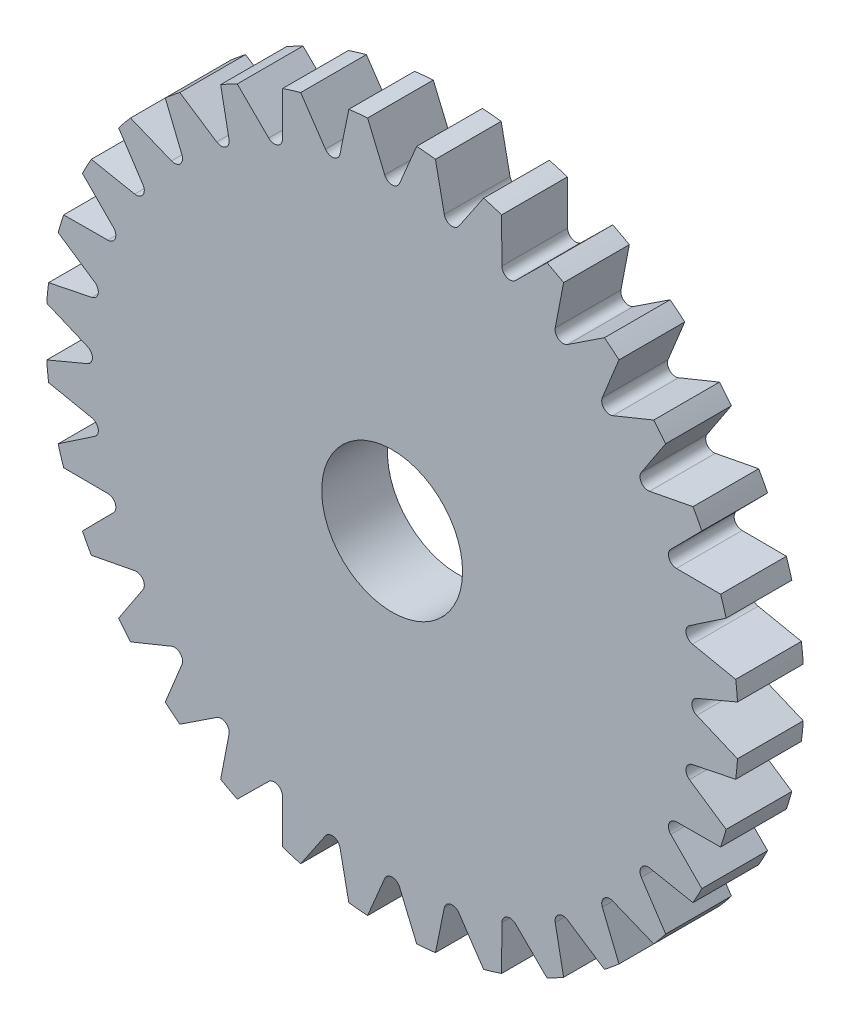
from build123d import *

# Parameters (mm, degrees)
SKETCH1_R           = 16.860601328
SKETCH1_R_2         = 3.429
BOSS_EXTRUDE1_DEPTH = 1.6002
CUT_EXTRUDE1_DEPTH  = 3.2004


with BuildPart() as part:
    # Sketch1 → Boss-Extrude1 (new, symmetric)
    with BuildSketch(Plane.XY):
        Circle(SKETCH1_R)
        Circle(SKETCH1_R_2, mode=Mode.SUBTRACT)
    extrude(amount=BOSS_EXTRUDE1_DEPTH, both=True)

    # Sketch2 → Cut-Extrude1 (cut)
    with BuildSketch(Plane.XY.offset(1.6002)):
        with BuildLine():
            Line((-1.195753421, 16.818146476), (-0.361266579, 14.83454632))
            ThreePointArc((-0.361266579, 14.83454632), (0, 14.594594775), (0.361266579, 14.83454632))
            Line((0.361266579, 14.83454632), (1.195753421, 16.818146476))
            ThreePointArc((1.195753421, 16.818146476), (0, 16.860601328), (-1.195753421, 16.818146476))
        make_face()
        with BuildLine():
            Line((4.453834966, 16.261710587), (3.248401362, 14.479025059))
            ThreePointArc((3.248401362, 14.479025059), (2.847264194, 14.314163729), (2.539751475, 14.619984285))
            Line((2.539751475, 14.619984285), (2.108280258, 16.728270427))
            ThreePointArc((2.108280258, 16.728270427), (3.289340142, 16.536629601), (4.453834966, 16.261710587))
        make_face()
        with BuildLine():
            Line((7.540758131, 15.080346281), (6.010701902, 13.567082984))
            ThreePointArc((6.010701902, 13.567082984), (5.585109623, 13.483647398), (5.343168305, 13.843584454))
            Line((5.343168305, 13.843584454), (5.331293908, 15.995536327))
            ThreePointArc((5.331293908, 15.995536327), (6.452272788, 15.577164472), (7.540758131, 15.080346281))
        make_face()
        with BuildLine():
            Line((10.33789419, 13.319452723), (8.542014538, 12.133765519))
            ThreePointArc((8.542014538, 12.133765519), (8.10832242, 12.134962059), (7.941250173, 12.535183435))
            Line((7.941250173, 12.535183435), (8.349428924, 14.648102736))
            ThreePointArc((8.349428924, 14.648102736), (9.367248208, 14.019077649), (10.33789419, 13.319452723))
        make_face()
        with BuildLine():
            Line((12.737750772, 11.046700068), (10.745062347, 10.23415425))
            ThreePointArc((10.745062347, 10.23415425), (10.319936934, 10.319936934), (10.23415425, 10.745062347))
            Line((10.23415425, 10.745062347), (11.046700068, 12.737750772))
            ThreePointArc((11.046700068, 12.737750772), (11.922245534, 11.922245534), (12.737750772, 11.046700068))
        make_face()
        with BuildLine():
            Line((14.648102736, 8.349428924), (12.535183435, 7.941250173))
            ThreePointArc((12.535183435, 7.941250173), (12.134962059, 8.10832242), (12.133765519, 8.542014538))
            Line((12.133765519, 8.542014538), (13.319452723, 10.33789419))
            ThreePointArc((13.319452723, 10.33789419), (14.019077649, 9.367248208), (14.648102736, 8.349428924))
        make_face()
        with BuildLine():
            Line((15.995536327, 5.331293908), (13.843584454, 5.343168305))
            ThreePointArc((13.843584454, 5.343168305), (13.483647398, 5.585109623), (13.567082984, 6.010701902))
            Line((13.567082984, 6.010701902), (15.080346281, 7.540758131))
            ThreePointArc((15.080346281, 7.540758131), (15.577164472, 6.452272788), (15.995536327, 5.331293908))
        make_face()
        with BuildLine():
            Line((16.728270427, 2.108280258), (14.619984285, 2.539751475))
            ThreePointArc((14.619984285, 2.539751475), (14.314163729, 2.847264194), (14.479025059, 3.248401362))
            Line((14.479025059, 3.248401362), (16.261710587, 4.453834966))
            ThreePointArc((16.261710587, 4.453834966), (16.536629601, 3.289340142), (16.728270427, 2.108280258))
        make_face()
        with BuildLine():
            Line((16.818146476, -1.195753421), (14.83454632, -0.361266579))
            ThreePointArc((14.83454632, -0.361266579), (14.594594775, 0), (14.83454632, 0.361266579))
            Line((14.83454632, 0.361266579), (16.818146476, 1.195753421))
            ThreePointArc((16.818146476, 1.195753421), (16.860601328, 0), (16.818146476, -1.195753421))
        make_face()
        with BuildLine():
            Line((16.261710587, -4.453834966), (14.479025059, -3.248401362))
            ThreePointArc((14.479025059, -3.248401362), (14.314163729, -2.847264194), (14.619984285, -2.539751475))
            Line((14.619984285, -2.539751475), (16.728270427, -2.108280258))
            ThreePointArc((16.728270427, -2.108280258), (16.536629601, -3.289340142), (16.261710587, -4.453834966))
        make_face()
        with BuildLine():
            Line((15.080346281, -7.540758131), (13.567082984, -6.010701902))
            ThreePointArc((13.567082984, -6.010701902), (13.483647398, -5.585109623), (13.843584454, -5.343168305))
            Line((13.843584454, -5.343168305), (15.995536327, -5.331293908))
            ThreePointArc((15.995536327, -5.331293908), (15.577164472, -6.452272788), (15.080346281, -7.540758131))
        make_face()
        with BuildLine():
            Line((13.319452723, -10.33789419), (12.133765519, -8.542014538))
            ThreePointArc((12.133765519, -8.542014538), (12.134962059, -8.10832242), (12.535183435, -7.941250173))
            Line((12.535183435, -7.941250173), (14.648102736, -8.349428924))
            ThreePointArc((14.648102736, -8.349428924), (14.019077649, -9.367248208), (13.319452723, -10.33789419))
        make_face()
        with BuildLine():
            Line((11.046700068, -12.737750772), (10.23415425, -10.745062347))
            ThreePointArc((10.23415425, -10.745062347), (10.319936934, -10.319936934), (10.745062347, -10.23415425))
            Line((10.745062347, -10.23415425), (12.737750772, -11.046700068))
            ThreePointArc((12.737750772, -11.046700068), (11.922245534, -11.922245534), (11.046700068, -12.737750772))
        make_face()
        with BuildLine():
            Line((8.349428924, -14.648102736), (7.941250173, -12.535183435))
            ThreePointArc((7.941250173, -12.535183435), (8.10832242, -12.134962059), (8.542014538, -12.133765519))
            Line((8.542014538, -12.133765519), (10.33789419, -13.319452723))
            ThreePointArc((10.33789419, -13.319452723), (9.367248208, -14.019077649), (8.349428924, -14.648102736))
        make_face()
        with BuildLine():
            Line((5.331293908, -15.995536327), (5.343168305, -13.843584454))
            ThreePointArc((5.343168305, -13.843584454), (5.585109623, -13.483647398), (6.010701902, -13.567082984))
            Line((6.010701902, -13.567082984), (7.540758131, -15.080346281))
            ThreePointArc((7.540758131, -15.080346281), (6.452272788, -15.577164472), (5.331293908, -15.995536327))
        make_face()
        with BuildLine():
            Line((2.108280258, -16.728270427), (2.539751475, -14.619984285))
            ThreePointArc((2.539751475, -14.619984285), (2.847264194, -14.314163729), (3.248401362, -14.479025059))
            Line((3.248401362, -14.479025059), (4.453834966, -16.261710587))
            ThreePointArc((4.453834966, -16.261710587), (3.289340142, -16.536629601), (2.108280258, -16.728270427))
        make_face()
        with BuildLine():
            Line((-1.195753421, -16.818146476), (-0.361266579, -14.83454632))
            ThreePointArc((-0.361266579, -14.83454632), (0, -14.594594775), (0.361266579, -14.83454632))
            Line((0.361266579, -14.83454632), (1.195753421, -16.818146476))
            ThreePointArc((1.195753421, -16.818146476), (0, -16.860601328), (-1.195753421, -16.818146476))
        make_face()
        with BuildLine():
            Line((-4.453834966, -16.261710587), (-3.248401362, -14.479025059))
            ThreePointArc((-3.248401362, -14.479025059), (-2.847264194, -14.314163729), (-2.539751475, -14.619984285))
            Line((-2.539751475, -14.619984285), (-2.108280258, -16.728270427))
            ThreePointArc((-2.108280258, -16.728270427), (-3.289340142, -16.536629601), (-4.453834966, -16.261710587))
        make_face()
        with BuildLine():
            Line((-7.540758131, -15.080346281), (-6.010701902, -13.567082984))
            ThreePointArc((-6.010701902, -13.567082984), (-5.585109623, -13.483647398), (-5.343168305, -13.843584454))
            Line((-5.343168305, -13.843584454), (-5.331293908, -15.995536327))
            ThreePointArc((-5.331293908, -15.995536327), (-6.452272788, -15.577164472), (-7.540758131, -15.080346281))
        make_face()
        with BuildLine():
            Line((-10.33789419, -13.319452723), (-8.542014538, -12.133765519))
            ThreePointArc((-8.542014538, -12.133765519), (-8.10832242, -12.134962059), (-7.941250173, -12.535183435))
            Line((-7.941250173, -12.535183435), (-8.349428924, -14.648102736))
            ThreePointArc((-8.349428924, -14.648102736), (-9.367248208, -14.019077649), (-10.33789419, -13.319452723))
        make_face()
        with BuildLine():
            Line((-12.737750772, -11.046700068), (-10.745062347, -10.23415425))
            ThreePointArc((-10.745062347, -10.23415425), (-10.319936934, -10.319936934), (-10.23415425, -10.745062347))
            Line((-10.23415425, -10.745062347), (-11.046700068, -12.737750772))
            ThreePointArc((-11.046700068, -12.737750772), (-11.922245534, -11.922245534), (-12.737750772, -11.046700068))
        make_face()
        with BuildLine():
            Line((-14.648102736, -8.349428924), (-12.535183435, -7.941250173))
            ThreePointArc((-12.535183435, -7.941250173), (-12.134962059, -8.10832242), (-12.133765519, -8.542014538))
            Line((-12.133765519, -8.542014538), (-13.319452723, -10.33789419))
            ThreePointArc((-13.319452723, -10.33789419), (-14.019077649, -9.367248208), (-14.648102736, -8.349428924))
        make_face()
        with BuildLine():
            Line((-15.995536327, -5.331293908), (-13.843584454, -5.343168305))
            ThreePointArc((-13.843584454, -5.343168305), (-13.483647398, -5.585109623), (-13.567082984, -6.010701902))
            Line((-13.567082984, -6.010701902), (-15.080346281, -7.540758131))
            ThreePointArc((-15.080346281, -7.540758131), (-15.577164472, -6.452272788), (-15.995536327, -5.331293908))
        make_face()
        with BuildLine():
            Line((-16.728270427, -2.108280258), (-14.619984285, -2.539751475))
            ThreePointArc((-14.619984285, -2.539751475), (-14.314163729, -2.847264194), (-14.479025059, -3.248401362))
            Line((-14.479025059, -3.248401362), (-16.261710587, -4.453834966))
            ThreePointArc((-16.261710587, -4.453834966), (-16.536629601, -3.289340142), (-16.728270427, -2.108280258))
        make_face()
        with BuildLine():
            Line((-16.818146476, 1.195753421), (-14.83454632, 0.361266579))
            ThreePointArc((-14.83454632, 0.361266579), (-14.594594775, 0), (-14.83454632, -0.361266579))
            Line((-14.83454632, -0.361266579), (-16.818146476, -1.195753421))
            ThreePointArc((-16.818146476, -1.195753421), (-16.860601328, 0), (-16.818146476, 1.195753421))
        make_face()
        with BuildLine():
            Line((-16.261710587, 4.453834966), (-14.479025059, 3.248401362))
            ThreePointArc((-14.479025059, 3.248401362), (-14.314163729, 2.847264194), (-14.619984285, 2.539751475))
            Line((-14.619984285, 2.539751475), (-16.728270427, 2.108280258))
            ThreePointArc((-16.728270427, 2.108280258), (-16.536629601, 3.289340142), (-16.261710587, 4.453834966))
        make_face()
        with BuildLine():
            Line((-15.080346281, 7.540758131), (-13.567082984, 6.010701902))
            ThreePointArc((-13.567082984, 6.010701902), (-13.483647398, 5.585109623), (-13.843584454, 5.343168305))
            Line((-13.843584454, 5.343168305), (-15.995536327, 5.331293908))
            ThreePointArc((-15.995536327, 5.331293908), (-15.577164472, 6.452272788), (-15.080346281, 7.540758131))
        make_face()
        with BuildLine():
            Line((-13.319452723, 10.33789419), (-12.133765519, 8.542014538))
            ThreePointArc((-12.133765519, 8.542014538), (-12.134962059, 8.10832242), (-12.535183435, 7.941250173))
            Line((-12.535183435, 7.941250173), (-14.648102736, 8.349428924))
            ThreePointArc((-14.648102736, 8.349428924), (-14.019077649, 9.367248208), (-13.319452723, 10.33789419))
        make_face()
        with BuildLine():
            Line((-11.046700068, 12.737750772), (-10.23415425, 10.745062347))
            ThreePointArc((-10.23415425, 10.745062347), (-10.319936934, 10.319936934), (-10.745062347, 10.23415425))
            Line((-10.745062347, 10.23415425), (-12.737750772, 11.046700068))
            ThreePointArc((-12.737750772, 11.046700068), (-11.922245534, 11.922245534), (-11.046700068, 12.737750772))
        make_face()
        with BuildLine():
            Line((-8.349428924, 14.648102736), (-7.941250173, 12.535183435))
            ThreePointArc((-7.941250173, 12.535183435), (-8.10832242, 12.134962059), (-8.542014538, 12.133765519))
            Line((-8.542014538, 12.133765519), (-10.33789419, 13.319452723))
            ThreePointArc((-10.33789419, 13.319452723), (-9.367248208, 14.019077649), (-8.349428924, 14.648102736))
        make_face()
        with BuildLine():
            Line((-5.331293908, 15.995536327), (-5.343168305, 13.843584454))
            ThreePointArc((-5.343168305, 13.843584454), (-5.585109623, 13.483647398), (-6.010701902, 13.567082984))
            Line((-6.010701902, 13.567082984), (-7.540758131, 15.080346281))
            ThreePointArc((-7.540758131, 15.080346281), (-6.452272788, 15.577164472), (-5.331293908, 15.995536327))
        make_face()
        with BuildLine():
            Line((-2.108280258, 16.728270427), (-2.539751475, 14.619984285))
            ThreePointArc((-2.539751475, 14.619984285), (-2.847264194, 14.314163729), (-3.248401362, 14.479025059))
            Line((-3.248401362, 14.479025059), (-4.453834966, 16.261710587))
            ThreePointArc((-4.453834966, 16.261710587), (-3.289340142, 16.536629601), (-2.108280258, 16.728270427))
        make_face()
    extrude(amount=-CUT_EXTRUDE1_DEPTH, mode=Mode.SUBTRACT)


solid = part.part
